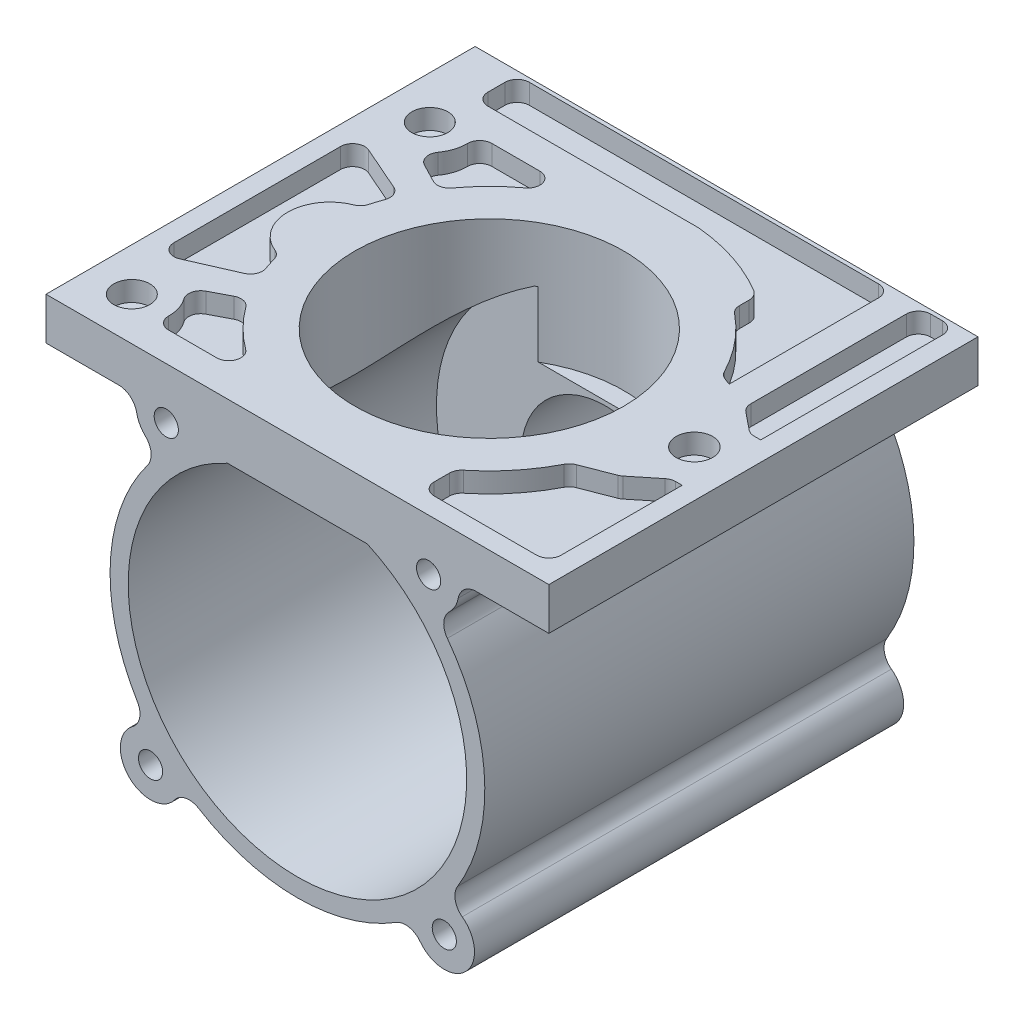
from build123d import *

# Parameters (mm, degrees)
SKETCH1_R           = 2
BOSS_EXTRUDE1_DEPTH = 71
BOSS_EXTRUDE2_START = -20
BOSS_EXTRUDE2_DEPTH = 20
SKETCH4_R           = 22.25
CUT_EXTRUDE1_DEPTH  = 20
SKETCH5_R           = 3.022127891
SKETCH5_R_2         = 2.984467426
CUT_EXTRUDE2_DEPTH  = 3.3
BOSS_EXTRUDE3_START = -53.3
SKETCH6_R           = 2
BOSS_EXTRUDE3_DEPTH = 53.3
SKETCH7_R           = 22.25
CUT_EXTRUDE4_DEPTH  = 20
SKETCH8_R           = 14
CUT_EXTRUDE5_DEPTH  = 29


with BuildPart() as part:
    # Sketch1 → Boss-Extrude1 (new body)
    with BuildSketch(Plane.XY):
        with BuildLine():
            Line((-41.6, 34.7), (41.6, 34.7))
            Line((41.6, 34.7), (41.6, 27.7))
            Line((41.6, 27.7), (29.558116823, 27.7))
            ThreePointArc((29.558116823, 27.7), (27.645984505, 27.011655251), (26.611323014, 25.2625))
            ThreePointArc((26.611323014, 25.2625), (26.087125484, 23.80143168), (25.140096153, 22.571537728))
            ThreePointArc((25.140096153, 22.571537728), (24.214825318, 20.64727444), (24.803787329, 18.594949156))
            ThreePointArc((24.803787329, 18.594949156), (30.963546179, 1.502933138), (26.488095667, -16.1053031))
            ThreePointArc((26.488095667, -16.1053031), (26.107899632, -18.243064514), (27.269662352, -20.077425512))
            ThreePointArc((27.269662352, -20.077425512), (27.850113241, -27.620894202), (20.302105128, -27.102804788))
            ThreePointArc((20.302105128, -27.102804788), (18.458205593, -25.956241491), (16.323659246, -26.35409169))
            ThreePointArc((16.323659246, -26.35409169), (0, -31), (-16.323659246, -26.35409169))
            ThreePointArc((-16.323659246, -26.35409169), (-18.458205593, -25.956241491), (-20.302105128, -27.102804788))
            ThreePointArc((-20.302105128, -27.102804788), (-27.850113241, -27.620894202), (-27.269662352, -20.077425512))
            ThreePointArc((-27.269662352, -20.077425512), (-26.107899632, -18.243064514), (-26.488095667, -16.1053031))
            ThreePointArc((-26.488095667, -16.1053031), (-30.963546179, 1.502933138), (-24.803787329, 18.594949156))
            ThreePointArc((-24.803787329, 18.594949156), (-24.214825318, 20.64727444), (-25.140096153, 22.571537728))
            ThreePointArc((-25.140096153, 22.571537728), (-26.087125484, 23.80143168), (-26.611323014, 25.2625))
            ThreePointArc((-26.611323014, 25.2625), (-27.645984505, 27.011655251), (-29.558116823, 27.7))
            Line((-29.558116823, 27.7), (-41.6, 27.7))
            Line((-41.6, 27.7), (-41.6, 34.7))
        make_face()
        with Locations((-24.3, -24.1)):
            Circle(SKETCH1_R, mode=Mode.SUBTRACT)
        with Locations(Location((24.3, -24.1, 0), (0, 0, 180))):
            Circle(SKETCH1_R, mode=Mode.SUBTRACT)
        with Locations((-21.7, 26.2)):
            Circle(SKETCH1_R, mode=Mode.SUBTRACT)
        with Locations(Location((21.7, 26.2, 0), (0, 0, 180))):
            Circle(SKETCH1_R, mode=Mode.SUBTRACT)
        with BuildLine():
            Line((0, 25.5), (-11.565033506, 25.5))
            ThreePointArc((-11.565033506, 25.5), (0, -28), (11.565033506, 25.5))
            Line((11.565033506, 25.5), (0, 25.5))
        make_face(mode=Mode.SUBTRACT)
    extrude(amount=-BOSS_EXTRUDE1_DEPTH)

    # Sketch3 → Boss-Extrude2 (add)
    with BuildSketch(Plane(origin=(0, 0, -71), x_dir=(-1, 0, 0), z_dir=(0, 0, -1)).offset(BOSS_EXTRUDE2_START)):
        with BuildLine():
            Line((-11.565033506, 25.5), (11.565033506, 25.5))
            ThreePointArc((11.565033506, 25.5), (0, -28), (-11.565033506, 25.5))
        make_face()
    extrude(amount=BOSS_EXTRUDE2_DEPTH)

    # Sketch4 → Cut-Extrude1 (cut)
    with BuildSketch(Plane(origin=(0, 34.7, 0), x_dir=(1, 0, 0), z_dir=(0, 1, 0))):
        with Locations(Location((0, 31.75, 0), (0, 0, 180))):
            Circle(SKETCH4_R)
    extrude(amount=-CUT_EXTRUDE1_DEPTH, mode=Mode.SUBTRACT)

    # Sketch5 → Cut-Extrude2 (cut)
    with BuildSketch(Plane(origin=(0, 34.7, 0), x_dir=(1, 0, 0), z_dir=(0, 1, 0))):
        with Locations(Location((33.927872109, 31.75, 0), (0, 0, 180))):
            Circle(SKETCH5_R)
        with Locations(Location((-34.5, 7.1, 0), (0, 0, 180))):
            Circle(SKETCH5_R_2)
        with Locations((-34.5, 56.4)):
            Circle(SKETCH5_R_2)
        with BuildLine():
            Line((17.4, 5.222938284), (17.4, 7.752337891))
            ThreePointArc((17.4, 7.752337891), (17.597173424, 8.623464734), (18.150257171, 9.324776153))
            ThreePointArc((18.150257171, 9.324776153), (22.362877615, 13.522981462), (25.625145816, 18.495777959))
            ThreePointArc((25.625145816, 18.495777959), (26.071081355, 19.072193711), (26.692339737, 19.453181438))
            Line((26.692339737, 19.453181438), (31.637345031, 21.365422694))
            ThreePointArc((31.637345031, 21.365422694), (31.920318143, 21.500934926), (32.178933924, 21.67857283))
            Line((32.178933924, 21.67857283), (36.043799869, 24.800690212))
            ThreePointArc((36.043799869, 24.800690212), (36.640870302, 25.134367752), (37.315009001, 25.25))
            Line((37.315009001, 25.25), (38.4, 25.25))
            Line((38.4, 25.25), (38.4, 5.222938284))
            ThreePointArc((38.4, 5.222938284), (37.807495095, 3.792504905), (36.377061716, 3.2))
            Line((36.377061716, 3.2), (19.422938284, 3.2))
            ThreePointArc((19.422938284, 3.2), (17.992504905, 3.792504905), (17.4, 5.222938284))
        make_face()
        with BuildLine():
            Line((38.4, 38.25), (37.315009001, 38.25))
            ThreePointArc((37.315009001, 38.25), (36.640870302, 38.365632248), (36.043799869, 38.699309788))
            Line((36.043799869, 38.699309788), (33.151729153, 41.035583382))
            ThreePointArc((33.151729153, 41.035583382), (32.597581207, 41.737230892), (32.4, 42.609211879))
            Line((32.4, 42.609211879), (32.4, 68.330496056))
            ThreePointArc((32.4, 68.330496056), (32.992504905, 69.760929435), (34.422938284, 70.35343434))
            Line((34.422938284, 70.35343434), (36.377061716, 70.35343434))
            ThreePointArc((36.377061716, 70.35343434), (37.807495095, 69.760929435), (38.4, 68.330496056))
            Line((38.4, 68.330496056), (38.4, 38.25))
        make_face()
        with BuildLine():
            Line((27.8, 43.618484612), (26.692339737, 44.046818562))
            ThreePointArc((26.692339737, 44.046818562), (26.071081355, 44.427806289), (25.625145816, 45.004222041))
            ThreePointArc((25.625145816, 45.004222041), (22.362877615, 49.977018538), (18.150257171, 54.175223847))
            ThreePointArc((18.150257171, 54.175223847), (17.597173424, 54.876535266), (17.4, 55.747662109))
            Line((17.4, 55.747662109), (17.4, 57.336521607))
            ThreePointArc((17.4, 57.336521607), (17.137782315, 58.332584995), (16.41910772, 59.070424553))
            ThreePointArc((16.41910772, 59.070424553), (9.869306341, 62.058241262), (2.816060384, 63.5))
            Line((2.816060384, 63.5), (-31.977061716, 63.5))
            ThreePointArc((-31.977061716, 63.5), (-33.407495095, 64.092504905), (-34, 65.522938284))
            Line((-34, 65.522938284), (-34, 68.330496056))
            ThreePointArc((-34, 68.330496056), (-33.407495095, 69.760929435), (-31.977061716, 70.35343434))
            Line((-31.977061716, 70.35343434), (25.777061716, 70.35343434))
            ThreePointArc((25.777061716, 70.35343434), (27.207495095, 69.760929435), (27.8, 68.330496056))
            Line((27.8, 68.330496056), (27.8, 43.618484612))
        make_face()
        with BuildLine():
            Line((-35.596515067, 47.366259615), (-28.191539915, 44.117682775))
            ThreePointArc((-28.191539915, 44.117682775), (-27.15636094, 43.073143107), (-27.115282556, 41.603118892))
            ThreePointArc((-27.115282556, 41.603118892), (-27.46160788, 40.592092097), (-27.77025027, 39.568932147))
            ThreePointArc((-27.77025027, 39.568932147), (-28.20915438, 38.772659729), (-28.955222822, 38.252978614))
            ThreePointArc((-28.955222822, 38.252978614), (-33.364611091, 31.75), (-28.955222822, 25.247021386))
            ThreePointArc((-28.955222822, 25.247021386), (-28.20915438, 24.727340271), (-27.77025027, 23.931067853))
            ThreePointArc((-27.77025027, 23.931067853), (-27.46160788, 22.907907903), (-27.115282556, 21.896881108))
            ThreePointArc((-27.115282556, 21.896881108), (-27.15636094, 20.426856893), (-28.191539915, 19.382317225))
            Line((-28.191539915, 19.382317225), (-35.596515067, 16.133740385))
            ThreePointArc((-35.596515067, 16.133740385), (-37.493853311, 16.290884715), (-38.4, 17.965245767))
            Line((-38.4, 17.965245767), (-38.4, 45.534754233))
            ThreePointArc((-38.4, 45.534754233), (-37.493853311, 47.209115285), (-35.596515067, 47.366259615))
        make_face()
        with BuildLine():
            Line((-18.369728815, 5.007277506), (-26.334797191, 5.007277506))
            ThreePointArc((-26.334797191, 5.007277506), (-27.757017341, 5.60111612), (-28.334668249, 7.029987663))
            ThreePointArc((-28.334668249, 7.029987663), (-28.624699957, 8.970044578), (-29.509419908, 10.720818646))
            ThreePointArc((-29.509419908, 10.720818646), (-29.837700915, 12.352292131), (-28.817875571, 13.667370236))
            Line((-28.817875571, 13.667370236), (-25.756437816, 15.269338838))
            ThreePointArc((-25.756437816, 15.269338838), (-24.378292278, 15.445800084), (-23.217742786, 14.681896575))
            ThreePointArc((-23.217742786, 14.681896575), (-20.424298577, 11.421897229), (-17.177523303, 8.613093816))
            ThreePointArc((-17.177523303, 8.613093816), (-16.470830105, 6.379437009), (-18.369728815, 5.007277506))
        make_face()
        with BuildLine():
            Line((-18.369728815, 58.492722494), (-26.334797191, 58.492722494))
            ThreePointArc((-26.334797191, 58.492722494), (-27.757017341, 57.89888388), (-28.334668249, 56.470012337))
            ThreePointArc((-28.334668249, 56.470012337), (-28.624699957, 54.529955422), (-29.509419908, 52.779181354))
            ThreePointArc((-29.509419908, 52.779181354), (-29.837700915, 51.147707869), (-28.817875571, 49.832629764))
            Line((-28.817875571, 49.832629764), (-25.756437816, 48.230661162))
            ThreePointArc((-25.756437816, 48.230661162), (-24.378292278, 48.054199916), (-23.217742786, 48.818103425))
            ThreePointArc((-23.217742786, 48.818103425), (-20.424298577, 52.078102771), (-17.177523303, 54.886906184))
            ThreePointArc((-17.177523303, 54.886906184), (-16.470830105, 57.120562991), (-18.369728815, 58.492722494))
        make_face()
    extrude(amount=-CUT_EXTRUDE2_DEPTH, mode=Mode.SUBTRACT)

    # Sketch6 → Boss-Extrude3 (add)
    with BuildSketch(Plane(origin=(0, 0, -71), x_dir=(-1, 0, 0), z_dir=(0, 0, -1)).offset(BOSS_EXTRUDE3_START)):
        with Locations((-21.7, 26.2)):
            Circle(SKETCH6_R)
        with Locations(Location((21.7, 26.2, 0), (0, 0, 180))):
            Circle(SKETCH6_R)
        with Locations(Location((24.3, -24.1, 0), (0, 0, 180))):
            Circle(SKETCH6_R)
        with Locations((-24.3, -24.1)):
            Circle(SKETCH6_R)
    extrude(amount=BOSS_EXTRUDE3_DEPTH)

    # Sketch7 → Cut-Extrude4 (cut)
    with BuildSketch(Plane(origin=(0, 34.7, 0), x_dir=(1, 0, 0), z_dir=(0, 1, 0))):
        with Locations(Location((0, 31.75, 0), (0, 0, 180))):
            Circle(SKETCH7_R)
    extrude(amount=-CUT_EXTRUDE4_DEPTH, mode=Mode.SUBTRACT)

    # Sketch8 → Cut-Extrude5 (cut)
    with BuildSketch(Plane.XY.offset(-51)):
        Circle(SKETCH8_R)
    extrude(amount=-CUT_EXTRUDE5_DEPTH, mode=Mode.SUBTRACT)


solid = part.part
